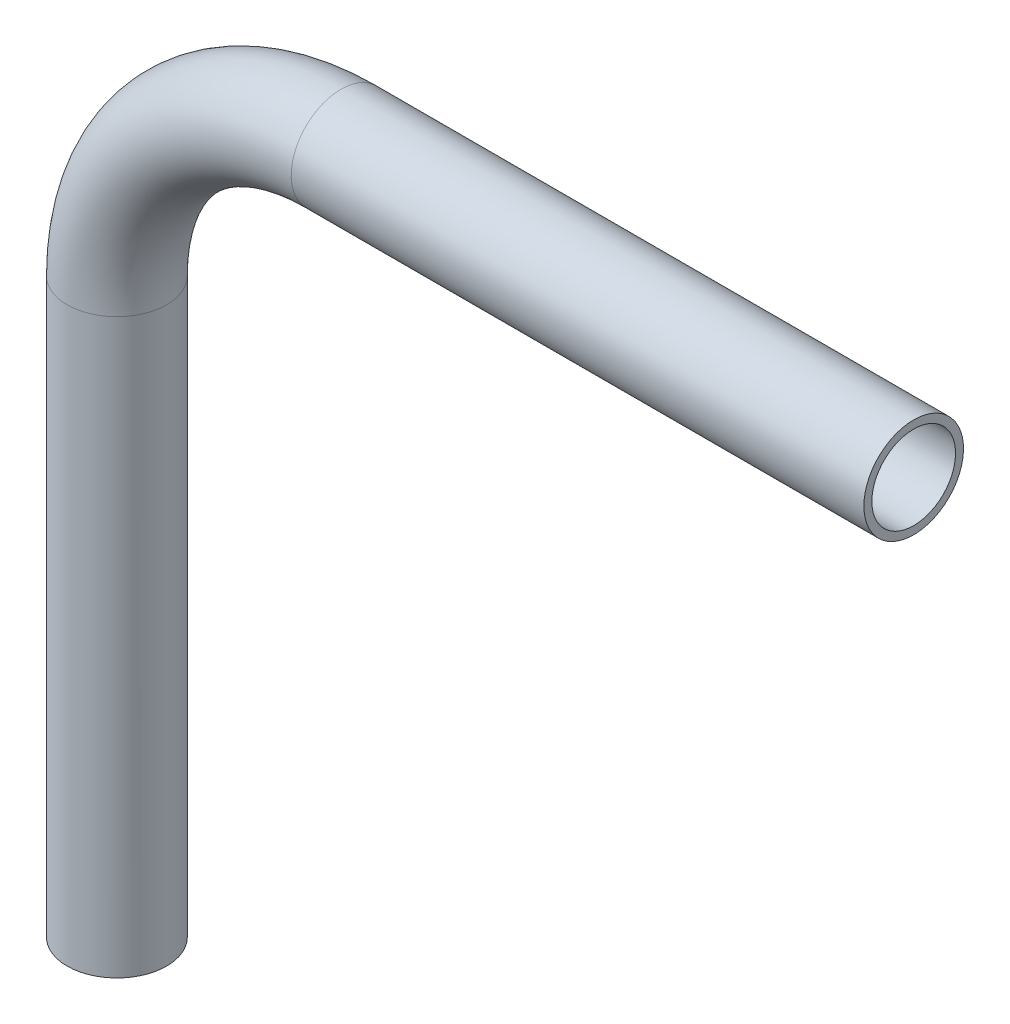
from build123d import *

# Parameters (mm, degrees)
SKETCH2_R   = 3.175
SKETCH2_R_2 = 2.667


with BuildPart() as part:
    # Sweep1: sweep along a path in Sketch1
    with BuildLine(Plane.XY) as sweep1_path:
        Line((0, 0), (0, 36.5125))
        ThreePointArc((0, 36.5125), (4.184711864, 46.615288136), (14.2875, 50.8))
        Line((14.2875, 50.8), (50.8, 50.8))
    # Sketch2 → Sweep1 (sweep)
    with BuildSketch(Plane(origin=(0, 0, 0), x_dir=(1, 0, 0), z_dir=(0, 1, 0))):
        Circle(SKETCH2_R)
        Circle(SKETCH2_R_2, mode=Mode.SUBTRACT)
    sweep(path=sweep1_path.line)


solid = part.part
